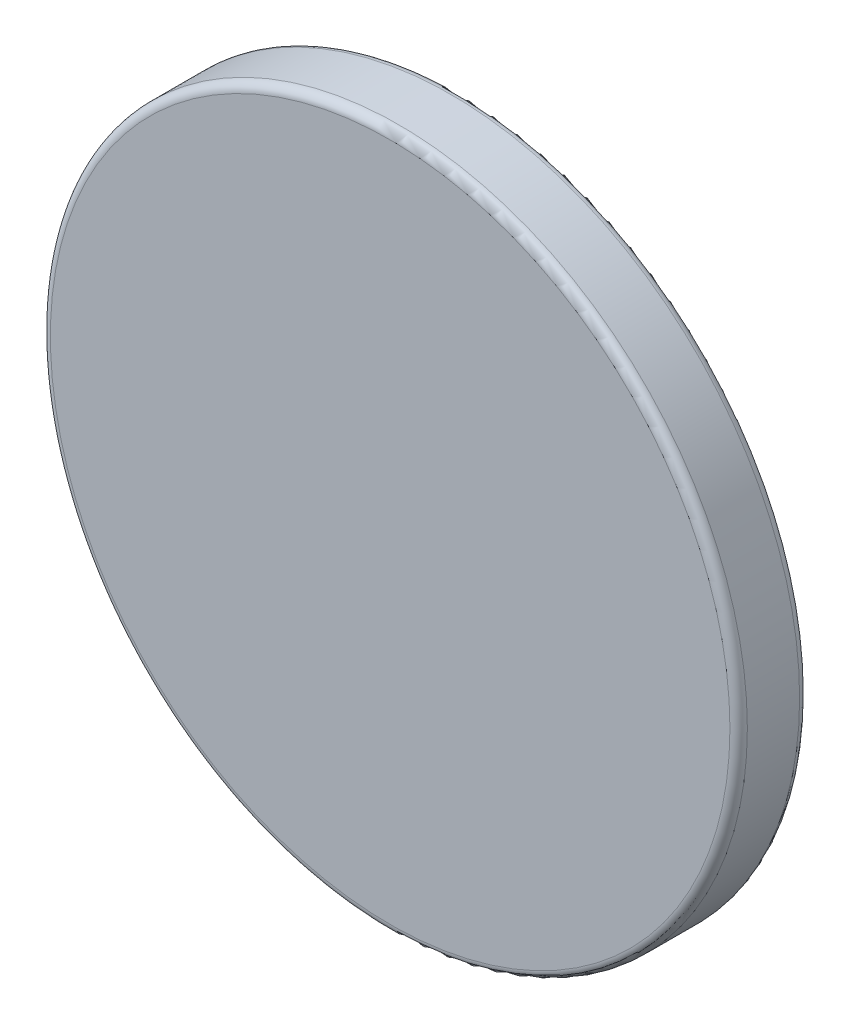
from build123d import *

# Parameters (mm, degrees)
ESQUISSE1_R             = 10
BOSS_EXTRU_1_DEPTH      = 2
CONG_1_R                = 0.25
ENL_V_MAT_EXTRU_1_DEPTH = 0.25


with BuildPart() as part:
    # Esquisse1 → Boss.-Extru.1 (new body)
    with BuildSketch(Plane.XY):
        Circle(ESQUISSE1_R)
    extrude(amount=BOSS_EXTRU_1_DEPTH)

    # Congé1
    cong_1_edges = [part.edges().sort_by_distance(p)[0] for p in [
        (-10, 0, 0),
        (-10, 0, 2),
    ]]
    fillet(cong_1_edges, radius=CONG_1_R)

    # Esquisse2 → Enlèv. mat.-Extru.1 (cut)
    with BuildSketch(Plane(origin=(0, 0, 0), x_dir=(-1, 0, 0), z_dir=(0, 0, -1))):
        with BuildLine():
            Line((-1.923076923, -1.852508928), (-1.415865385, -1.54842239))
            add(Edge.make_bspline(
                [(-1.415865385, -1.54842239), (-1.368691264, -1.627389907), (-1.278307468, -1.778688622), (-1.12753371, -1.983130977), (-0.971305862, -2.156894674), (-0.808467004, -2.298968859), (-0.640011093, -2.410824093), (-0.46483843, -2.490027919), (-0.283539326, -2.539426734), (-0.160155632, -2.545426882), (-0.098557692, -2.54842239)],
                knots=[0, 0, 0, 0, 1.272034388, 2.437168799, 3.508375237, 4.49857839, 5.41946034, 6.295179144, 7.148887113, 8, 8, 8, 8], degree=3))
            add(Edge.make_bspline(
                [(-0.098557692, -2.54842239), (-0.045951646, -2.546957237), (0.058339965, -2.544052568), (0.211875239, -2.516142621), (0.3609869, -2.473264686), (0.502601707, -2.411857375), (0.634765618, -2.337562828), (0.75066281, -2.247826524), (0.850856147, -2.147358742), (0.932814629, -2.035274192), (0.99569469, -1.914730508), (1.04402395, -1.791000306), (1.070844076, -1.662139903), (1.074884225, -1.57537911), (1.076923077, -1.531595467)],
                knots=[0, 0, 0, 0, 1.095163259, 2.171163733, 3.241058638, 4.321873601, 5.38011039, 6.391990106, 7.366004449, 8.327778327, 9.272591725, 10.192022065, 11.087607919, 12, 12, 12, 12], degree=3))
            add(Edge.make_bspline(
                [(1.076923077, -1.531595467), (1.074395687, -1.481639724), (1.069257873, -1.380087), (1.025832479, -1.230259023), (0.957519484, -1.081986046), (0.894497809, -0.990269591), (0.861778846, -0.942653159)],
                knots=[0, 0, 0, 0, 0.938893495, 1.908633276, 2.914225137, 4, 4, 4, 4], degree=3))
            add(Edge.make_bspline(
                [(0.861778846, -0.942653159), (0.834914936, -0.908287176), (0.778517517, -0.836140092), (0.681561781, -0.72874826), (0.5677913, -0.617973828), (0.441099491, -0.499586873), (0.296871339, -0.379093507), (0.139624172, -0.250747888), (-0.03465673, -0.119430899), (-0.156884438, -0.031363643), (-0.219951923, 0.01407761)],
                knots=[0, 0, 0, 0, 0.722233717, 1.516239348, 2.393582979, 3.351407094, 4.387010283, 5.505090956, 6.712668013, 8, 8, 8, 8], degree=3))
            add(Edge.make_bspline(
                [(-0.219951923, 0.01407761), (-0.283078774, 0.059040903), (-0.403772505, 0.145007296), (-0.572558646, 0.272591783), (-0.723492011, 0.389238416), (-0.855901754, 0.496045294), (-0.969729634, 0.593026902), (-1.065872625, 0.679251941), (-1.14188158, 0.757052331), (-1.184148289, 0.807523202), (-1.203125, 0.83018338)],
                knots=[0, 0, 0, 0, 1.452282411, 2.77665338, 3.964542531, 5.026858415, 5.96415736, 6.766646006, 7.446254459, 8, 8, 8, 8], degree=3))
            add(Edge.make_bspline(
                [(-1.203125, 0.83018338), (-1.229649363, 0.865499443), (-1.281813083, 0.934953221), (-1.350669093, 1.04351012), (-1.409193372, 1.154635718), (-1.455071655, 1.268628628), (-1.493705173, 1.383888506), (-1.519690198, 1.501919213), (-1.535961164, 1.622191131), (-1.537627426, 1.70312856), (-1.538461538, 1.743644918)],
                knots=[0, 0, 0, 0, 1.068054152, 2.10047183, 3.106115577, 4.101338837, 5.06977816, 6.043150881, 7.020423561, 8, 8, 8, 8], degree=3))
            add(Edge.make_bspline(
                [(-1.538461538, 1.743644918), (-1.536224037, 1.807124532), (-1.53179686, 1.932726927), (-1.494355973, 2.11620835), (-1.435259584, 2.291385065), (-1.352468348, 2.45652278), (-1.245741457, 2.607321605), (-1.122234073, 2.745516154), (-0.975128668, 2.861690866), (-0.813724171, 2.963197252), (-0.637056104, 3.04264741), (-0.451928841, 3.102580518), (-0.258048146, 3.136539246), (-0.126728487, 3.141412557), (-0.060096154, 3.143885303)],
                knots=[0, 0, 0, 0, 1.005424448, 1.989358655, 2.955360095, 3.929531133, 4.905563448, 5.876582895, 6.856512386, 7.866279853, 8.892233794, 9.918561126, 10.94386622, 12, 12, 12, 12], degree=3))
            add(Edge.make_bspline(
                [(-0.060096154, 3.143885303), (0.010608018, 3.141446643), (0.15121605, 3.136596927), (0.358043276, 3.09442973), (0.557175933, 3.02465715), (0.717364387, 2.945476593), (0.842734835, 2.866394166), (0.938345234, 2.794360182), (1.035232293, 2.711431424), (1.134177529, 2.617387002), (1.233504374, 2.511364001), (1.334687435, 2.394088534), (1.437963325, 2.266277295), (1.504401942, 2.175035294), (1.538461538, 2.128260303)],
                knots=[0, 0, 0, 0, 1.286793592, 2.559021753, 3.825965368, 5.121522368, 5.803751409, 6.523245864, 7.299691795, 8.125521123, 9.008227632, 9.944561021, 10.946284179, 12, 12, 12, 12], degree=3))
            Line((1.538461538, 2.128260303), (1.051682692, 1.759269918))
            add(Edge.make_bspline(
                [(1.051682692, 1.759269918), (1.022289665, 1.797136244), (0.965685567, 1.870057936), (0.879749304, 1.972180191), (0.798751622, 2.065465585), (0.718950937, 2.146491518), (0.644561854, 2.219695175), (0.57236121, 2.282369044), (0.503388037, 2.335127208), (0.416444761, 2.391430454), (0.307214387, 2.447241602), (0.170098039, 2.494468593), (0.026807282, 2.5228487), (-0.070786372, 2.526601078), (-0.120192308, 2.528500687)],
                knots=[0, 0, 0, 0, 1.181633172, 2.275549214, 3.290209073, 4.226197932, 5.078386478, 5.862611352, 6.581680152, 7.217281963, 8.414376989, 9.595101626, 10.782541182, 12, 12, 12, 12], degree=3))
            add(Edge.make_bspline(
                [(-0.120192308, 2.528500687), (-0.182174918, 2.526423487), (-0.301702542, 2.522417803), (-0.471400089, 2.478669257), (-0.624132532, 2.409786068), (-0.755365501, 2.313246105), (-0.86462889, 2.198867261), (-0.943666819, 2.067246366), (-0.99123853, 1.921905105), (-0.997043581, 1.820519408), (-1, 1.768885303)],
                knots=[0, 0, 0, 0, 1.14458467, 2.207223713, 3.21896685, 4.227309161, 5.202851033, 6.127160689, 7.046193047, 8, 8, 8, 8], degree=3))
            add(Edge.make_bspline(
                [(-1, 1.768885303), (-0.999326069, 1.736739911), (-0.997977104, 1.672396563), (-0.979163165, 1.577336983), (-0.954992887, 1.482517544), (-0.916691232, 1.388364545), (-0.863813569, 1.293231358), (-0.794376125, 1.195479808), (-0.706924732, 1.094248307), (-0.639935568, 1.028407095), (-0.604567308, 0.993644918)],
                knots=[0, 0, 0, 0, 0.858281714, 1.717966888, 2.583508476, 3.4729293, 4.427298488, 5.488583878, 6.674047936, 8, 8, 8, 8], degree=3))
            add(Edge.make_bspline(
                [(-0.604567308, 0.993644918), (-0.591433526, 0.981924302), (-0.560230668, 0.954078802), (-0.503186224, 0.908492036), (-0.427855713, 0.852258712), (-0.336206225, 0.782680455), (-0.226547891, 0.701969377), (-0.098868652, 0.61115747), (0.045408262, 0.507296683), (0.147788689, 0.434683757), (0.201923077, 0.396289149)],
                knots=[0, 0, 0, 0, 0.420754252, 0.999615792, 1.744751191, 2.668019286, 3.750313428, 4.999500688, 6.413464383, 8, 8, 8, 8], degree=3))
            add(Edge.make_bspline(
                [(0.201923077, 0.396289149), (0.267041785, 0.348903961), (0.393135139, 0.257149112), (0.572548133, 0.119293661), (0.735223233, -0.015531085), (0.881731582, -0.146464126), (1.013520568, -0.272512285), (1.129128089, -0.395192023), (1.229732112, -0.513624434), (1.338039344, -0.665463135), (1.448709892, -0.851944993), (1.543752476, -1.080421974), (1.603681072, -1.309787095), (1.611517955, -1.463947386), (1.615384615, -1.540008928)],
                knots=[0, 0, 0, 0, 1.163667725, 2.253281268, 3.268753668, 4.215851969, 5.092017293, 5.902905408, 6.650798638, 7.335211899, 8.59617414, 9.77448103, 10.901945474, 12, 12, 12, 12], degree=3))
            add(Edge.make_bspline(
                [(1.615384615, -1.540008928), (1.614258093, -1.593800411), (1.612026924, -1.700338783), (1.586379643, -1.856776058), (1.548803075, -2.008714691), (1.492167816, -2.154276598), (1.423042402, -2.296124763), (1.335328834, -2.430538307), (1.233658518, -2.560492133), (1.117029206, -2.682520975), (0.98940766, -2.794543025), (0.854521326, -2.894192845), (0.712149429, -2.977281399), (0.563064315, -3.045082843), (0.407231738, -3.09811173), (0.244704109, -3.136533791), (0.075213518, -3.16011501), (-0.039987308, -3.162562601), (-0.098557692, -3.163807005)],
                knots=[0, 0, 0, 0, 0.983748083, 1.948392443, 2.894712957, 3.844097841, 4.80183111, 5.778335162, 6.776009319, 7.81870978, 8.863265674, 9.881300176, 10.883814829, 11.87499822, 12.874611388, 13.892143829, 14.928324115, 16, 16, 16, 16], degree=3))
            add(Edge.make_bspline(
                [(-0.098557692, -3.163807005), (-0.143875423, -3.162930694), (-0.233940155, -3.161189107), (-0.367156409, -3.145792627), (-0.497681419, -3.12400902), (-0.623877331, -3.089424901), (-0.747370037, -3.047464368), (-0.867622439, -2.995798655), (-0.984692817, -2.933883453), (-1.099237245, -2.863091982), (-1.210964401, -2.780707277), (-1.318826346, -2.684752712), (-1.426362093, -2.577874703), (-1.53039763, -2.45717088), (-1.633037305, -2.32459131), (-1.732257436, -2.178895567), (-1.830111809, -2.020877246), (-1.891509754, -1.909679956), (-1.923076923, -1.852508928)],
                knots=[0, 0, 0, 0, 0.915332311, 1.819136955, 2.706846663, 3.586547465, 4.459518054, 5.340707479, 6.227863349, 7.133153174, 8.059268498, 9.028702269, 10.047606654, 11.120612155, 12.245963614, 13.433783089, 14.680604001, 16, 16, 16, 16], degree=3))
        make_face()
    extrude(amount=-ENL_V_MAT_EXTRU_1_DEPTH, mode=Mode.SUBTRACT)


solid = part.part
